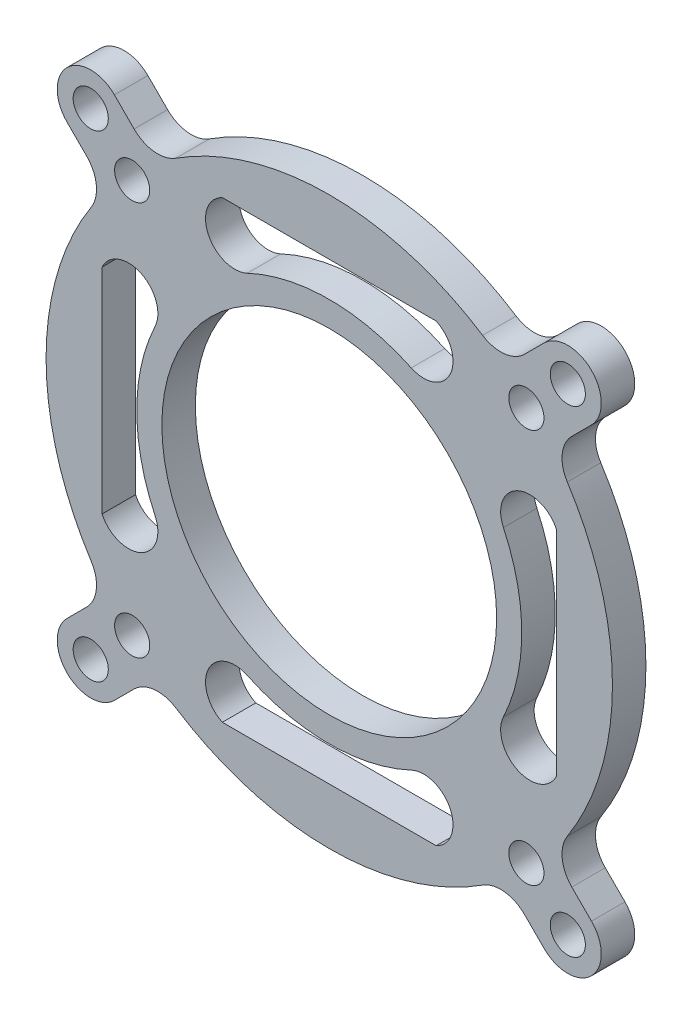
from build123d import *

# Parameters (mm, degrees)
SKETCH_1_R      = 2.1
SKETCH_1_R_2    = 20
EXTRUDE_1_DEPTH = 4


with BuildPart() as part:
    # 草图1 → 凸台-拉伸1 (new body)
    with BuildSketch(Plane.XY):
        with BuildLine():
            Line((49.221320344, -54.878174593), (46.870064467, -52.526918716))
            ThreePointArc((46.870064467, -52.526918716), (44.466937039, -51.378020085), (41.875216056, -51.992814233))
            ThreePointArc((41.875216056, -51.992814233), (23.55, -57.385), (5.224783944, -51.992814233))
            ThreePointArc((5.224783944, -51.992814233), (2.633062961, -51.378020085), (0.229935533, -52.526918716))
            Line((0.229935533, -52.526918716), (-2.121320344, -54.878174593))
            ThreePointArc((-2.121320344, -54.878174593), (-7.778174593, -54.878174593), (-7.778174593, -49.221320343))
            Line((-7.778174593, -49.221320343), (-5.426918716, -46.870064467))
            ThreePointArc((-5.426918716, -46.870064467), (-4.278020085, -44.466937039), (-4.892814234, -41.875216055))
            ThreePointArc((-4.892814234, -41.875216055), (-10.285, -23.55), (-4.892814233, -5.224783944))
            ThreePointArc((-4.892814233, -5.224783944), (-4.278020085, -2.633062961), (-5.426918716, -0.229935533))
            Line((-5.426918716, -0.229935533), (-7.778174593, 2.121320344))
            ThreePointArc((-7.778174593, 2.121320344), (-7.778174593, 7.778174593), (-2.121320343, 7.778174593))
            Line((-2.121320343, 7.778174593), (0.229935534, 5.426918716))
            ThreePointArc((0.229935534, 5.426918716), (2.633062961, 4.278020085), (5.224783945, 4.892814234))
            ThreePointArc((5.224783945, 4.892814234), (23.55, 10.285), (41.875216056, 4.892814233))
            ThreePointArc((41.875216056, 4.892814233), (44.466937039, 4.278020085), (46.870064467, 5.426918716))
            Line((46.870064467, 5.426918716), (49.221320344, 7.778174593))
            ThreePointArc((49.221320344, 7.778174593), (54.878174593, 7.778174593), (54.878174593, 2.121320344))
            Line((54.878174593, 2.121320344), (52.526918716, -0.229935533))
            ThreePointArc((52.526918716, -0.229935533), (51.378020085, -2.633062961), (51.992814234, -5.224783945))
            ThreePointArc((51.992814234, -5.224783945), (57.385, -23.55), (51.992814233, -41.875216056))
            ThreePointArc((51.992814233, -41.875216056), (51.378020085, -44.466937039), (52.526918716, -46.870064467))
            Line((52.526918716, -46.870064467), (54.878174593, -49.221320344))
            ThreePointArc((54.878174593, -49.221320344), (54.878174593, -54.878174593), (49.221320344, -54.878174593))
        make_face()
        with Locations((47.1, -47.1)):
            Circle(SKETCH_1_R, mode=Mode.SUBTRACT)
        with Locations((23.55, -23.55)):
            Circle(SKETCH_1_R_2, mode=Mode.SUBTRACT)
        with Locations((52.049747468, -52.049747468)):
            Circle(SKETCH_1_R, mode=Mode.SUBTRACT)
        with Locations((-4.949747468, -52.049747468)):
            Circle(SKETCH_1_R, mode=Mode.SUBTRACT)
        with Locations((-4.949747468, 4.949747468)):
            Circle(SKETCH_1_R, mode=Mode.SUBTRACT)
        with Locations((52.049747468, 4.949747468)):
            Circle(SKETCH_1_R, mode=Mode.SUBTRACT)
        with Locations((0, -47.1)):
            Circle(SKETCH_1_R, mode=Mode.SUBTRACT)
        Circle(SKETCH_1_R, mode=Mode.SUBTRACT)
        with Locations((47.1, 0)):
            Circle(SKETCH_1_R, mode=Mode.SUBTRACT)
        with BuildLine():
            Line((10.774989316, 3.594043583), (36.325010684, 3.594043583))
            ThreePointArc((36.325010684, 3.594043583), (38.001397856, -1.063179415), (33.344174858, -2.739566587))
            ThreePointArc((33.344174858, -2.739566587), (23.55, -0.55), (13.755825142, -2.739566587))
            ThreePointArc((13.755825142, -2.739566587), (9.098602144, -1.063179415), (10.774989316, 3.594043583))
        make_face(mode=Mode.SUBTRACT)
        with BuildLine():
            Line((-3.594043583, -36.325010684), (-3.594043583, -10.774989316))
            ThreePointArc((-3.594043583, -10.774989316), (1.063179415, -9.098602144), (2.739566587, -13.755825142))
            ThreePointArc((2.739566587, -13.755825142), (0.55, -23.55), (2.739566587, -33.344174858))
            ThreePointArc((2.739566587, -33.344174858), (1.063179415, -38.001397856), (-3.594043583, -36.325010684))
        make_face(mode=Mode.SUBTRACT)
        with BuildLine():
            Line((10.774989316, -50.694043583), (36.325010684, -50.694043583))
            ThreePointArc((36.325010684, -50.694043583), (38.001397856, -46.036820585), (33.344174858, -44.360433413))
            ThreePointArc((33.344174858, -44.360433413), (23.55, -46.55), (13.755825142, -44.360433413))
            ThreePointArc((13.755825142, -44.360433413), (9.098602144, -46.036820585), (10.774989316, -50.694043583))
        make_face(mode=Mode.SUBTRACT)
        with BuildLine():
            Line((50.694043583, -10.774989316), (50.694043583, -36.325010684))
            ThreePointArc((50.694043583, -36.325010684), (46.036820585, -38.001397856), (44.360433413, -33.344174858))
            ThreePointArc((44.360433413, -33.344174858), (46.55, -23.55), (44.360433413, -13.755825142))
            ThreePointArc((44.360433413, -13.755825142), (46.036820585, -9.098602144), (50.694043583, -10.774989316))
        make_face(mode=Mode.SUBTRACT)
    extrude(amount=EXTRUDE_1_DEPTH)


solid = part.part
